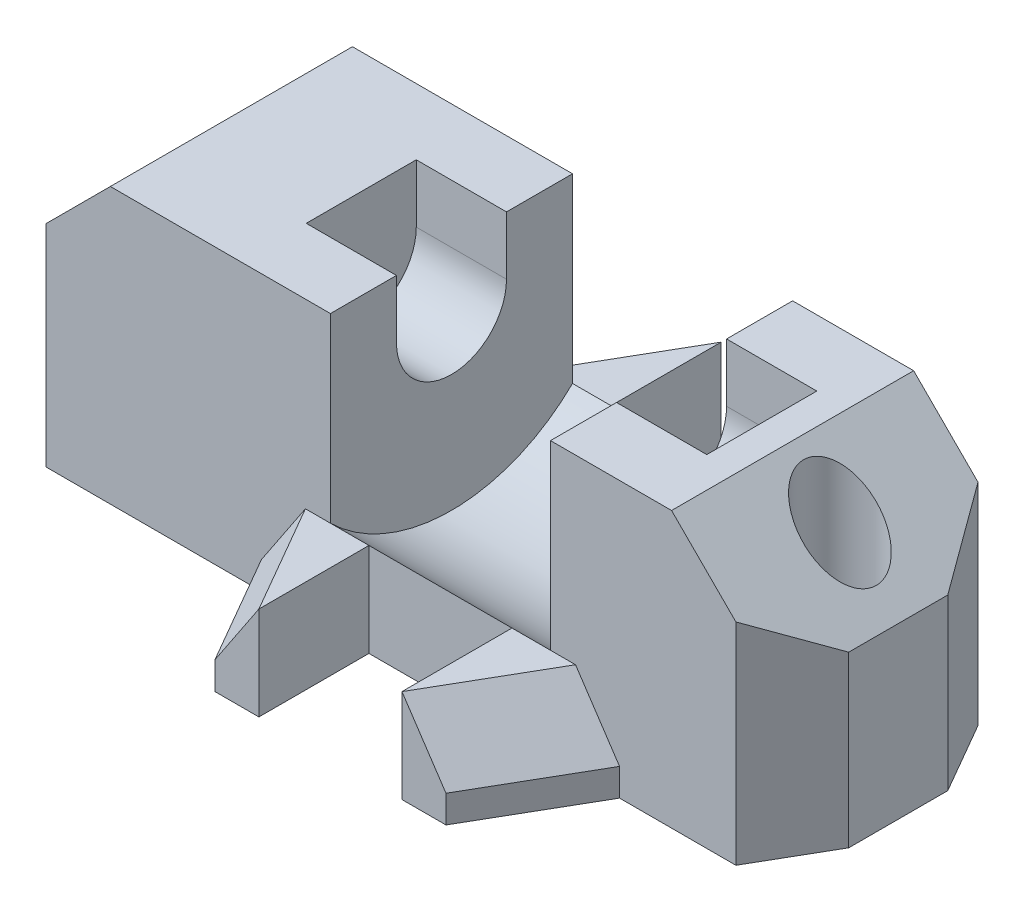
from build123d import *
from OCP.BRepFilletAPI import BRepFilletAPI_MakeChamfer

# Parameters (mm, degrees)
SKIZZE1_R                       = 1.65
AUFSATZ_LINEAR_AUSTRAGEN1_DEPTH = 12.5
SCHNITT_LINEAR_START            = -10.3
SKIZZE2_R                       = 7.85
SKIZZE2_R_2                     = 2.5
SCHNITT_LINEAR_AUSTRAGEN1_DEPTH = 10
SCHNITT_LINEAR_START_2          = -5.3
SCHNITT_LINEAR_AUSTRAGEN2_DEPTH = 20
SCHNITT_LINEAR_AUSTRAGEN3_DEPTH = 4.5
SCHNITT_LINEAR_START_3          = -11
SCHNITT_LINEAR_AUSTRAGEN4_DEPTH = 11
AUFSATZ_LINEAR_START            = -4.248884
AUFSATZ_LINEAR_AUSTRAGEN2_DEPTH = 4.248884
FASE1_SIZE                      = 3
FASE1_SIZE2                     = 1.732050808
AUFSATZ_LINEAR_START_2          = 4.5
AUFSATZ_LINEAR_AUSTRAGEN3_DEPTH = 4.5
AUFSATZ_LINEAR_START_3          = 0.9
AUFSATZ_LINEAR_AUSTRAGEN4_DEPTH = 0.9
AUFSATZ_LINEAR_AUSTRAGEN5_DEPTH = 0.9


with BuildPart() as part:
    # Skizze1 → Aufsatz-Linear austragen1 (new body)
    with BuildSketch(Plane(origin=(0, 0, 0), x_dir=(1, 0, 0), z_dir=(0, 1, 0))):
        Polygon((0, 11), (-31.34722325, 11), (-33.223611625, 7.75), (-33.223611625, 3.25), (-31.34722325, 0), (0, 0), (1.876388375, 3.25), (1.876388375, 7.75), align=None)
        with Locations(Location((-0.773611625, 5.5, 0), (0, 0, 270))):
            Circle(SKIZZE1_R, mode=Mode.SUBTRACT)
        with Locations(Location((-30.573611625, 5.5, 0), (0, 0, 270))):
            Circle(SKIZZE1_R, mode=Mode.SUBTRACT)
    extrude(amount=AUFSATZ_LINEAR_AUSTRAGEN1_DEPTH)

    # Skizze2 → Schnitt-Linear austragen1 (cut)
    with BuildSketch(Plane(origin=(1.876388375, 0, 0), x_dir=(0, 0, -1), z_dir=(1, 0, 0)).offset(SCHNITT_LINEAR_START)):
        with Locations((5.5, 9.85)):
            Circle(SKIZZE2_R)
        with Locations((5.5, 9.85)):
            Circle(SKIZZE2_R_2, mode=Mode.SUBTRACT)
    extrude(amount=-SCHNITT_LINEAR_AUSTRAGEN1_DEPTH, mode=Mode.SUBTRACT)

    # Skizze3 → Schnitt-Linear austragen2 (cut)
    with BuildSketch(Plane(origin=(1.876388375, 0, 0), x_dir=(0, 0, -1), z_dir=(1, 0, 0)).offset(SCHNITT_LINEAR_START_2)):
        with BuildLine():
            Line((7.75, 12.5), (3.25, 12.5))
            Line((3.25, 12.5), (3.25, 10.939724736))
            ThreePointArc((3.25, 10.939724736), (5.5, 12.35), (7.75, 10.939724736))
            Line((7.75, 10.939724736), (7.75, 12.5))
        make_face()
        with BuildLine():
            Line((8, 12.5), (7.75, 12.5))
            Line((7.75, 12.5), (7.75, 10.939724736))
            ThreePointArc((7.75, 10.939724736), (7.936698586, 10.409016994), (8, 9.85))
            Line((8, 9.85), (8, 12.5))
        make_face()
        with BuildLine():
            Line((3.25, 12.5), (3, 12.5))
            Line((3, 12.5), (3, 9.85))
            ThreePointArc((3, 9.85), (3.063301414, 10.409016994), (3.25, 10.939724736))
            Line((3.25, 10.939724736), (3.25, 12.5))
        make_face()
        with BuildLine():
            ThreePointArc((7.75, 10.939724736), (5.5, 12.35), (3.25, 10.939724736))
            Line((3.25, 10.939724736), (3.25, 8.760275264))
            ThreePointArc((3.25, 8.760275264), (5.5, 7.35), (7.75, 8.760275264))
            Line((7.75, 8.760275264), (7.75, 10.939724736))
        make_face()
        with BuildLine():
            ThreePointArc((3.25, 10.939724736), (3.063301414, 10.409016994), (3, 9.85))
            ThreePointArc((3, 9.85), (3.063301414, 9.290983006), (3.25, 8.760275264))
            Line((3.25, 8.760275264), (3.25, 10.939724736))
        make_face()
        with BuildLine():
            ThreePointArc((8, 9.85), (7.936698586, 10.409016994), (7.75, 10.939724736))
            Line((7.75, 10.939724736), (7.75, 8.760275264))
            ThreePointArc((7.75, 8.760275264), (7.936698586, 9.290983006), (8, 9.85))
        make_face()
    extrude(amount=-SCHNITT_LINEAR_AUSTRAGEN2_DEPTH, mode=Mode.SUBTRACT)

    # Skizze4 → Schnitt-Linear austragen3 (cut)
    with BuildSketch(Plane(origin=(-23.423611625, 0, 0), x_dir=(0, 0, -1), z_dir=(1, 0, 0))):
        with BuildLine():
            Line((10.25, 12.5), (0.75, 12.5))
            Line((0.75, 12.5), (0.75, 9.85))
            ThreePointArc((0.75, 9.85), (5.5, 5.1), (10.25, 9.85))
            Line((10.25, 9.85), (10.25, 12.5))
        make_face()
    extrude(amount=-SCHNITT_LINEAR_AUSTRAGEN3_DEPTH, mode=Mode.SUBTRACT)

    # Skizze5 → Schnitt-Linear austragen4 (cut)
    with BuildSketch(Plane.XY.offset(SCHNITT_LINEAR_START_3)):
        Polygon((1.876388375, 12.5), (-2.923611625, 12.5), (1.876388375, 7.7), align=None)
        Polygon((-33.223611625, 12.5), (-28.423611625, 12.5), (-33.223611625, 7.7), align=None)
    extrude(amount=SCHNITT_LINEAR_AUSTRAGEN4_DEPTH, mode=Mode.SUBTRACT)

    # Skizze6 → Aufsatz-Linear austragen2 (add)
    with BuildSketch(Plane.XZ.offset(AUFSATZ_LINEAR_START)):
        Polygon((-16.673611625, 0), (-16.673611625, 5), (-18.673611625, 5), (-21.560362971, 0), align=None)
        Polygon((-10.173611625, 0), (-10.173611625, 5), (-8.173611625, 5), (-5.286860279, 0), align=None)
        Polygon((-18.673611625, -16), (-21.560362971, -11), (-16.673611625, -11), (-16.673611625, -16), align=None)
        Polygon((-10.173611625, -11), (-5.286860279, -11), (-8.173611625, -16), (-10.173611625, -16), align=None)
    extrude(amount=AUFSATZ_LINEAR_AUSTRAGEN2_DEPTH)

    # Fase1: one chamfer whose edges measure the first distance from different faces: ONE call of the kernel's chamfer builder (chamfer() names one face for all edges)
    fase1_edges_1 = [part.edges().sort_by_distance(p)[0] for p in [
        (-6.730235952, 4.248884, -13.5),
    ]]
    fase1_side_1 = [part.faces().sort_by_distance(p)[0] for p in [
        (-6.730235952, 2.124442, -13.5),
    ]]
    fase1_edges_2 = [part.edges().sort_by_distance(p)[0] for p in [
        (-20.116987298, 4.248884, -13.5),
    ]]
    fase1_side_2 = [part.faces().sort_by_distance(p)[0] for p in [
        (-20.116987298, 2.124442, -13.5),
    ]]
    fase1_edges_3 = [part.edges().sort_by_distance(p)[0] for p in [
        (-6.730235952, 4.248884, 2.5),
    ]]
    fase1_side_3 = [part.faces().sort_by_distance(p)[0] for p in [
        (-6.730235952, 2.124442, 2.5),
    ]]
    fase1_edges_4 = [part.edges().sort_by_distance(p)[0] for p in [
        (-20.116987298, 4.248884, 2.5),
    ]]
    fase1_side_4 = [part.faces().sort_by_distance(p)[0] for p in [
        (-20.116987298, 2.124442, 2.5),
    ]]
    fase1 = BRepFilletAPI_MakeChamfer(part.part.solid().wrapped)
    for e in fase1_edges_1:
        fase1.Add(FASE1_SIZE, FASE1_SIZE2, e.wrapped, fase1_side_1[0].wrapped)  # the first distance lies on this face
    for e in fase1_edges_2:
        fase1.Add(FASE1_SIZE, FASE1_SIZE2, e.wrapped, fase1_side_2[0].wrapped)  # the first distance lies on this face
    for e in fase1_edges_3:
        fase1.Add(FASE1_SIZE, FASE1_SIZE2, e.wrapped, fase1_side_3[0].wrapped)  # the first distance lies on this face
    for e in fase1_edges_4:
        fase1.Add(FASE1_SIZE, FASE1_SIZE2, e.wrapped, fase1_side_4[0].wrapped)  # the first distance lies on this face
    add(Compound.cast(fase1.Shape()), mode=Mode.REPLACE)

    # Skizze7 → Aufsatz-Linear austragen3 (add)
    with BuildSketch(Plane(origin=(-27.923611625, 0, 0), x_dir=(0, 0, -1), z_dir=(1, 0, 0)).offset(AUFSATZ_LINEAR_START_2)):
        with BuildLine():
            Line((10.25, 12.5), (0.75, 12.5))
            Line((0.75, 12.5), (0.75, 9.85))
            ThreePointArc((0.75, 9.85), (5.5, 5.1), (10.25, 9.85))
            Line((10.25, 9.85), (10.25, 12.5))
        make_face()
    extrude(amount=-AUFSATZ_LINEAR_AUSTRAGEN3_DEPTH)

    # Skizze8 → Aufsatz-Linear austragen4 (add)
    with BuildSketch(Plane(origin=(-23.423611625, 0, 0), x_dir=(0, 0, -1), z_dir=(1, 0, 0)).offset(AUFSATZ_LINEAR_START_3)):
        with BuildLine():
            Line((8, 12.5), (3, 12.5))
            Line((3, 12.5), (3, 9.85))
            ThreePointArc((3, 9.85), (5.5, 7.35), (8, 9.85))
            Line((8, 9.85), (8, 12.5))
        make_face()
    extrude(amount=-AUFSATZ_LINEAR_AUSTRAGEN4_DEPTH)

    # Skizze9 → Aufsatz-Linear austragen5 (add)
    with BuildSketch(Plane.ZY.offset(3.423611625)):
        with BuildLine():
            Line((-3, 9.85), (-3, 12.5))
            Line((-3, 12.5), (-8, 12.5))
            Line((-8, 12.5), (-8, 9.85))
            ThreePointArc((-8, 9.85), (-5.5, 7.35), (-3, 9.85))
        make_face()
    extrude(amount=AUFSATZ_LINEAR_AUSTRAGEN5_DEPTH)


solid = part.part
